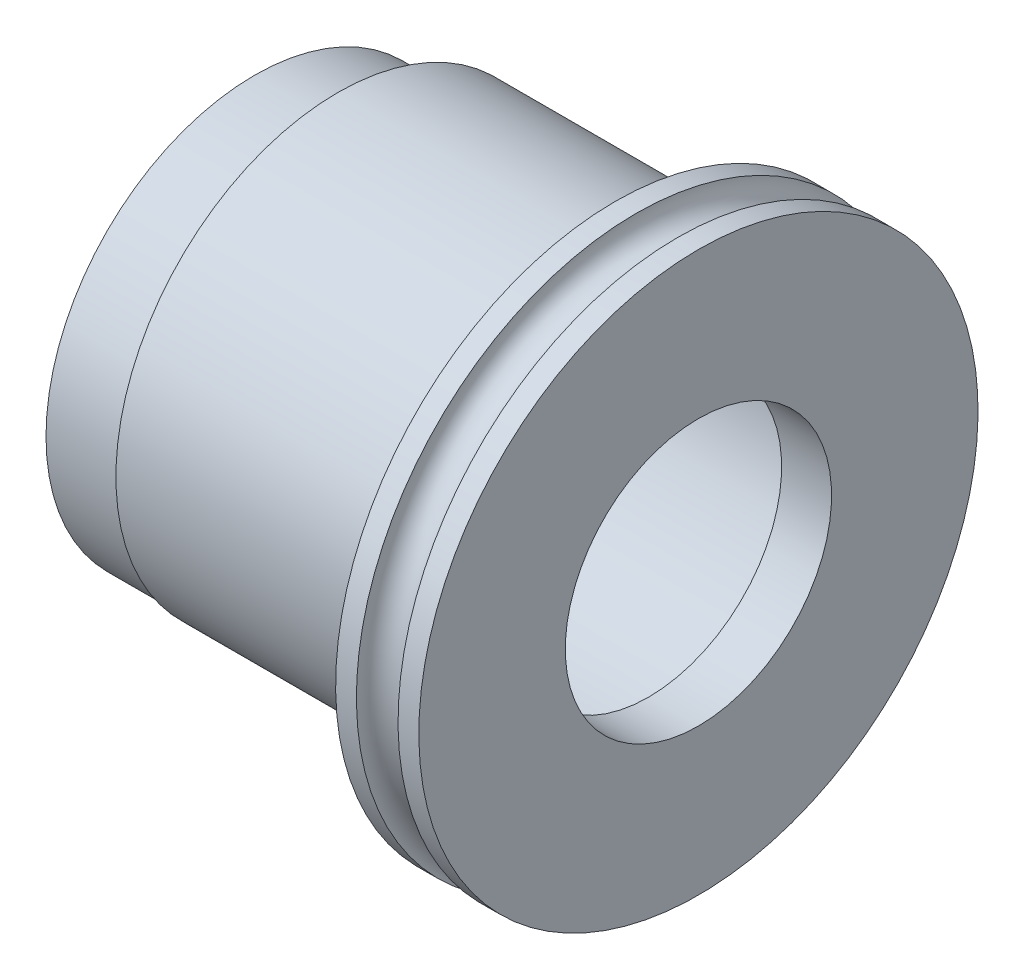
from build123d import *

# Parameters (mm, degrees)
SKETCH1_W = 15.875
SKETCH1_H = 12.7


with BuildPart() as part:
    # Sketch1 → Colar press section (revolve)
    with BuildSketch(Plane.XY):
        with Locations((0, 6.35)):
            Rectangle(SKETCH1_W, SKETCH1_H)
    revolve(axis=Axis((-7.9375, 0, 0), (1, 0, 0)))

    # Sketch7 → Revolve2 (revolve)
    with BuildSketch(Plane.XY):
        with BuildLine():
            Line((12.7, -0.762), (7.9375, -0.762))
            Line((7.9375, -0.762), (7.9375, 15.24))
            Line((7.9375, 15.24), (9.128125, 15.24))
            ThreePointArc((9.128125, 15.24), (10.31875, 14.049375), (11.509375, 15.24))
            Line((11.509375, 15.24), (12.7, 15.24))
            Line((12.7, 15.24), (12.7, -0.762))
        make_face()
        Polygon((-12.7, -0.762), (-7.9375, -0.762), (-7.9375, -12.7), (-9.128125, -12.7), (-11.509375, -12.7), (-12.7, -12.7), align=None)
    revolve(axis=Axis((39.064984039, -0.762, 0), (-1, 0, 0)))

    # Sketch8 → Cut-Revolve3 (revolve, cut)
    with BuildSketch(Plane.XY):
        Polygon((-12.7, -0.762), (12.7, -0.762), (12.7, 6.858), (9.8425, 6.858), (9.8425, 10.238), (-12.7, 10.238), align=None)
    revolve(axis=Axis((39.064984039, -0.762, 0), (-1, 0, 0)), mode=Mode.SUBTRACT)


solid = part.part
